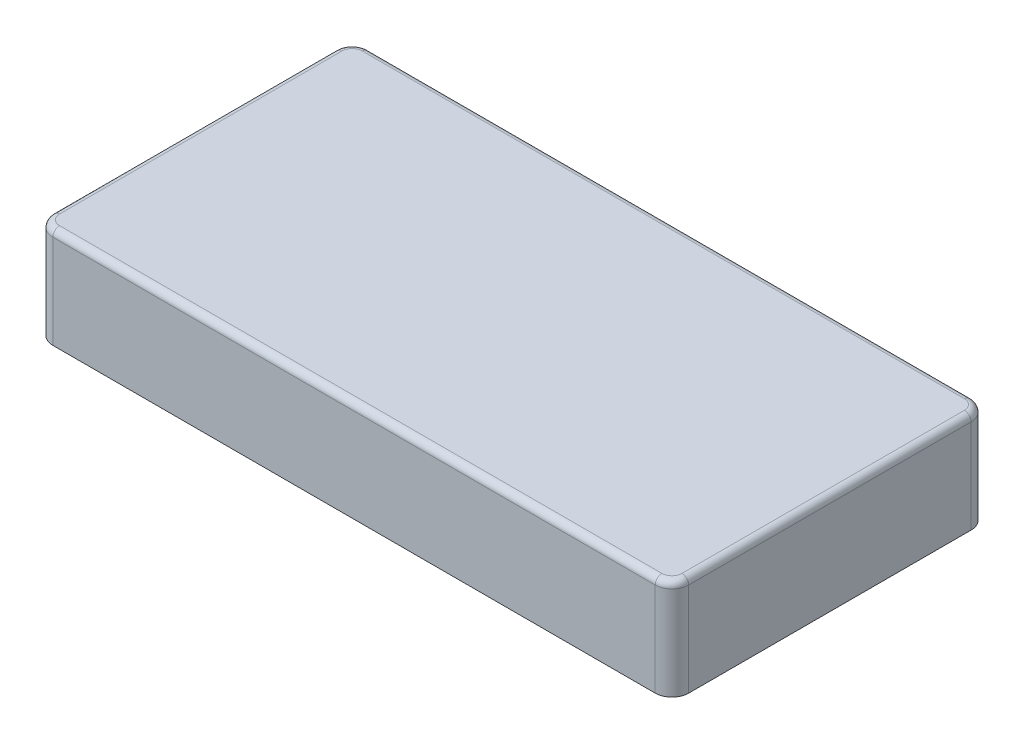
from build123d import *

# Parameters (mm, degrees)
EXTRUDE_1_DEPTH = 3
FILLET_1_R      = 0.2


with BuildPart() as part:
    # Эскиз1 → Бобышка-Вытянуть1 (new body)
    with BuildSketch(Plane(origin=(0, 0, 0), x_dir=(1, 0, 0), z_dir=(0, 1, 0))):
        with BuildLine():
            Line((-9, 4.72), (9, 4.72))
            ThreePointArc((9, 4.72), (9.353553391, 4.573553391), (9.5, 4.22))
            Line((9.5, 4.22), (9.5, -4.22))
            ThreePointArc((9.5, -4.22), (9.353553391, -4.573553391), (9, -4.72))
            Line((9, -4.72), (-9, -4.72))
            ThreePointArc((-9, -4.72), (-9.353553391, -4.573553391), (-9.5, -4.22))
            Line((-9.5, -4.22), (-9.5, 4.22))
            ThreePointArc((-9.5, 4.22), (-9.353553391, 4.573553391), (-9, 4.72))
        make_face()
    extrude(amount=EXTRUDE_1_DEPTH)

    # Скругление1
    fillet_1_edges = [part.edges().sort_by_distance(p)[0] for p in [
        (-9.353553391, 3, -4.573553391),
        (-9.5, 3, 0),
        (-9.353553391, 3, 4.573553391),
        (0, 3, 4.72),
        (9.353553391, 3, 4.573553391),
        (9.5, 3, 0),
        (9.353553391, 3, -4.573553391),
        (0, 3, -4.72),
    ]]
    fillet(fillet_1_edges, radius=FILLET_1_R)


solid = part.part
